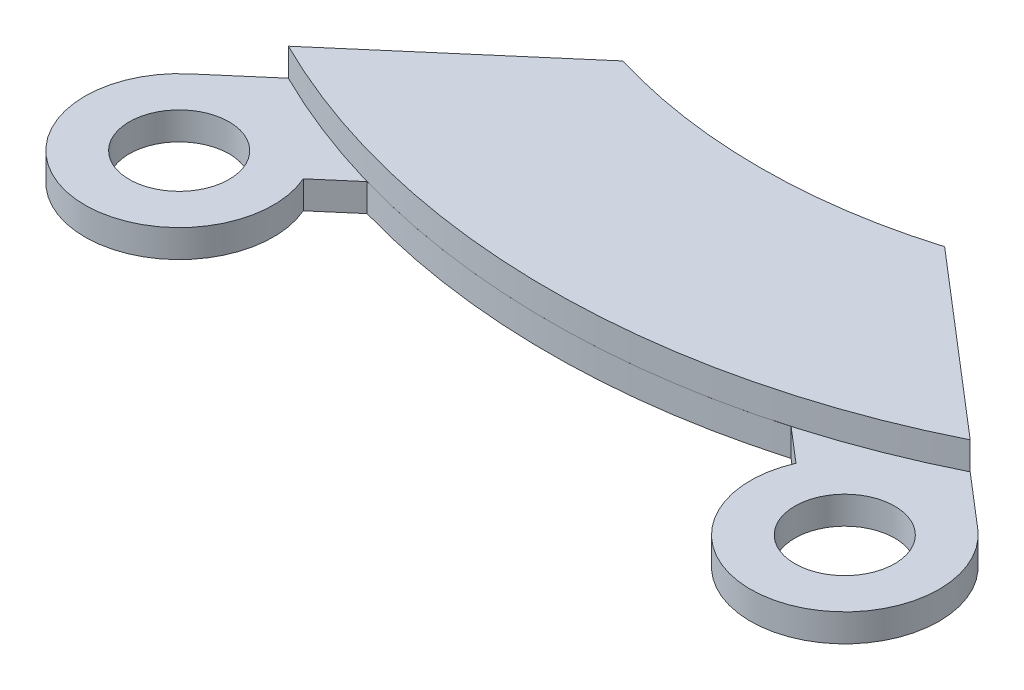
from build123d import *

# Parameters (mm, degrees)
SKETCH1_R           = 5.715
BOSS_EXTRUDE1_DEPTH = 3.175
BOSS_EXTRUDE2_DEPTH = 3.175


with BuildPart() as part:
    # Sketch1 → Boss-Extrude1 (new body)
    with BuildSketch(Plane(origin=(0, 0, 0), x_dir=(1, 0, 0), z_dir=(0, 1, 0))):
        with BuildLine():
            Line((45.129586045, 8.192493212), (18.415, 31.115))
            ThreePointArc((18.415, 31.115), (0, 28.386191983), (-18.415, 31.115))
            Line((-18.415, 31.115), (-45.129586045, 8.192493212))
            ThreePointArc((-45.129586045, 8.192493212), (-40.513842398, -10.521662886), (-28.202341812, 4.309105173))
            Line((-28.202341812, 4.309105173), (-24.269223655, 7.683925486))
            ThreePointArc((-24.269223655, 7.683925486), (0, 4.256191983), (24.269223655, 7.683925486))
            Line((24.269223655, 7.683925486), (28.202341812, 4.309105173))
            ThreePointArc((28.202341812, 4.309105173), (40.513842398, -10.521662886), (45.129586045, 8.192493212))
        make_face()
        with Locations(Location((38.1, 0, 0), (0, 0, 270))):
            Circle(SKETCH1_R, mode=Mode.SUBTRACT)
        with Locations(Location((-38.1, 0, 0), (0, 0, 90))):
            Circle(SKETCH1_R, mode=Mode.SUBTRACT)
    extrude(amount=BOSS_EXTRUDE1_DEPTH)


with BuildPart() as body_2:
    # Sketch2 → Boss-Extrude2 (new body)
    with BuildSketch(Plane(origin=(0, 3.175, 0), x_dir=(1, 0, 0), z_dir=(0, 1, 0))):
        with BuildLine():
            Line((-18.415, 31.115), (-39.028657392, 13.427407885))
            ThreePointArc((-39.028657392, 13.427407885), (0, 4.256191983), (39.028657392, 13.427407885))
            Line((39.028657392, 13.427407885), (18.415, 31.115))
            ThreePointArc((18.415, 31.115), (0, 28.386191983), (-18.415, 31.115))
        make_face()
    extrude(amount=BOSS_EXTRUDE2_DEPTH)


solid = Compound([part.part, body_2.part])
